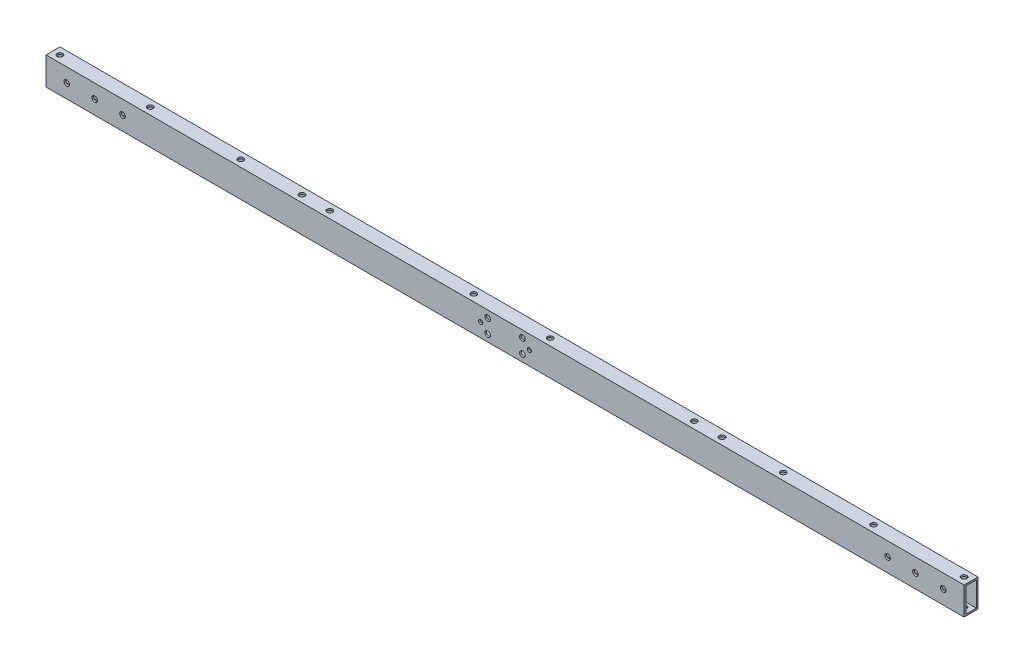
from build123d import *

# Parameters (mm, degrees)
SKETCH_1_W          = 10
SKETCH_1_H          = 20
SKETCH_1_W_2        = 7.6
SKETCH_1_H_2        = 17.6
EXTRUDE_1_DEPTH     = 660
SKETCH_2_R          = 2
CUT_EXTRUDE_1_DEPTH = 661.321891202
SKETCH_3_R          = 1.5
SKETCH_3_R_2        = 2
CUT_EXTRUDE_2_DEPTH = 661.151497764


with BuildPart() as part:
    # ｽｹｯﾁ1 → 押し出し-薄板1 (new body)
    with BuildSketch(Plane(origin=(0, 0, 0), x_dir=(0, 0, -1), z_dir=(1, 0, 0))):
        Rectangle(SKETCH_1_W, SKETCH_1_H)
        Rectangle(SKETCH_1_W_2, SKETCH_1_H_2, mode=Mode.SUBTRACT)
    extrude(amount=EXTRUDE_1_DEPTH)

    # ｽｹｯﾁ2 → ｶｯﾄ - 押し出し1 (cut, through all)
    with BuildSketch(Plane(origin=(0, 10, 0), x_dir=(1, 0, 0), z_dir=(0, 1, 0))):
        with Locations(Location((5, 0, 0), (0, 0, 270))):
            Circle(SKETCH_2_R)
        with Locations(Location((70, 0, 0), (0, 0, 270))):
            Circle(SKETCH_2_R)
        with Locations(Location((135, 0, 0), (0, 0, 270))):
            Circle(SKETCH_2_R)
        with Locations(Location((525, 0, 0), (0, 0, 270))):
            Circle(SKETCH_2_R)
        with Locations(Location((590, 0, 0), (0, 0, 270))):
            Circle(SKETCH_2_R)
        with Locations(Location((655, 0, 0), (0, 0, 270))):
            Circle(SKETCH_2_R)
        with Locations(Location((199, 0, 0), (0, 0, 270))):
            Circle(SKETCH_2_R)
        with Locations(Location((179, 0, 0), (0, 0, 270))):
            Circle(SKETCH_2_R)
        with Locations(Location((481, 0, 0), (0, 0, 270))):
            Circle(SKETCH_2_R)
        with Locations(Location((461, 0, 0), (0, 0, 270))):
            Circle(SKETCH_2_R)
        with Locations(Location((357.5, 0, 0), (0, 0, 270))):
            Circle(SKETCH_2_R)
        with Locations(Location((302.5, 0, 0), (0, 0, 270))):
            Circle(SKETCH_2_R)
    extrude(amount=-CUT_EXTRUDE_1_DEPTH, mode=Mode.SUBTRACT)

    # ｽｹｯﾁ3 → ｶｯﾄ - 押し出し2 (cut, through all)
    with BuildSketch(Plane.XY.offset(5)):
        with Locations((347.5, 0)):
            Circle(SKETCH_3_R)
        with Locations(Location((312.5, 0, 0), (0, 0, 90))):
            Circle(SKETCH_3_R)
        with Locations((342.5, 5)):
            Circle(SKETCH_3_R_2)
        with Locations(Location((342.5, -5, 0), (0, 0, 90))):
            Circle(SKETCH_3_R_2)
        with Locations((317.5, -5)):
            Circle(SKETCH_3_R_2)
        with Locations(Location((317.5, 5, 0), (0, 0, 90))):
            Circle(SKETCH_3_R_2)
        with Locations((15, 0)):
            Circle(SKETCH_3_R_2)
        with Locations((35, 0)):
            Circle(SKETCH_3_R_2)
        with Locations((55, 0)):
            Circle(SKETCH_3_R_2)
        with Locations(Location((605, 0, 0), (0, 0, 90))):
            Circle(SKETCH_3_R_2)
        with Locations(Location((625, 0, 0), (0, 0, 90))):
            Circle(SKETCH_3_R_2)
        with Locations(Location((645, 0, 0), (0, 0, 90))):
            Circle(SKETCH_3_R_2)
    extrude(amount=-CUT_EXTRUDE_2_DEPTH, mode=Mode.SUBTRACT)


solid = part.part
